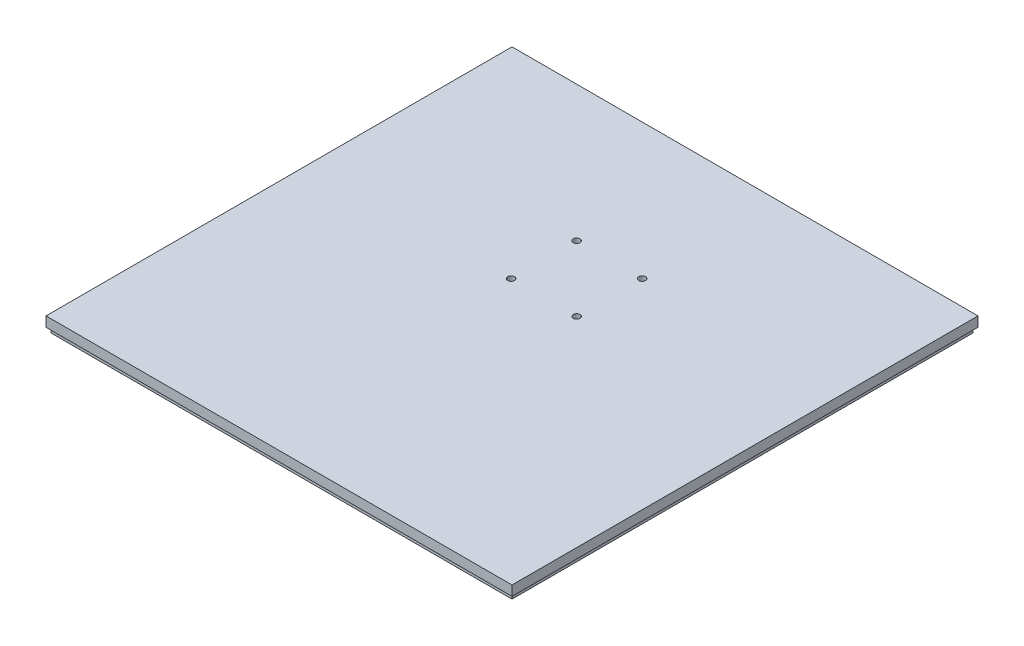
from build123d import *

# Parameters (mm, degrees)
SKETCH1_W           = 593.725
SKETCH1_H           = 593.725
BOSS_EXTRUDE1_DEPTH = 19.05
SKETCH3_W           = 600.075
SKETCH3_H           = 600.075
BOSS_EXTRUDE2_DEPTH = 12.7
SKETCH4_R           = 4.365625
CUT_EXTRUDE1_DEPTH  = 19.05


with BuildPart() as part:
    # Sketch1 → Boss-Extrude1 (new body)
    with BuildSketch(Plane(origin=(-151.113711937, 667.527127164, 96.73817395), x_dir=(1, 0, 0), z_dir=(0, 1, 0))):
        with Locations((151.113711937, 96.73817395)):
            Rectangle(SKETCH1_W, SKETCH1_H)
    extrude(amount=BOSS_EXTRUDE1_DEPTH)

    # Sketch3 → Boss-Extrude2 (add)
    with BuildSketch(Plane(origin=(0, 686.577127164, 0), x_dir=(1, 0, 0), z_dir=(0, 1, 0))):
        Rectangle(SKETCH3_W, SKETCH3_H)
    extrude(amount=-BOSS_EXTRUDE2_DEPTH)

    # Sketch4 → Cut-Extrude1 (cut)
    with BuildSketch(Plane.XZ.offset(-667.527127164)):
        with Locations(Location((42.207203769, -40.998092462, 0), (0, 0, 270))):
            Circle(SKETCH4_R)
        with Locations(Location((-42.207203769, -40.998092462, 0), (0, 0, 270))):
            Circle(SKETCH4_R)
        with Locations(Location((-42.207203769, -125.4125, 0), (0, 0, 270))):
            Circle(SKETCH4_R)
        with Locations(Location((42.207203769, -125.4125, 0), (0, 0, 270))):
            Circle(SKETCH4_R)
    extrude(amount=-CUT_EXTRUDE1_DEPTH, mode=Mode.SUBTRACT)


solid = part.part
